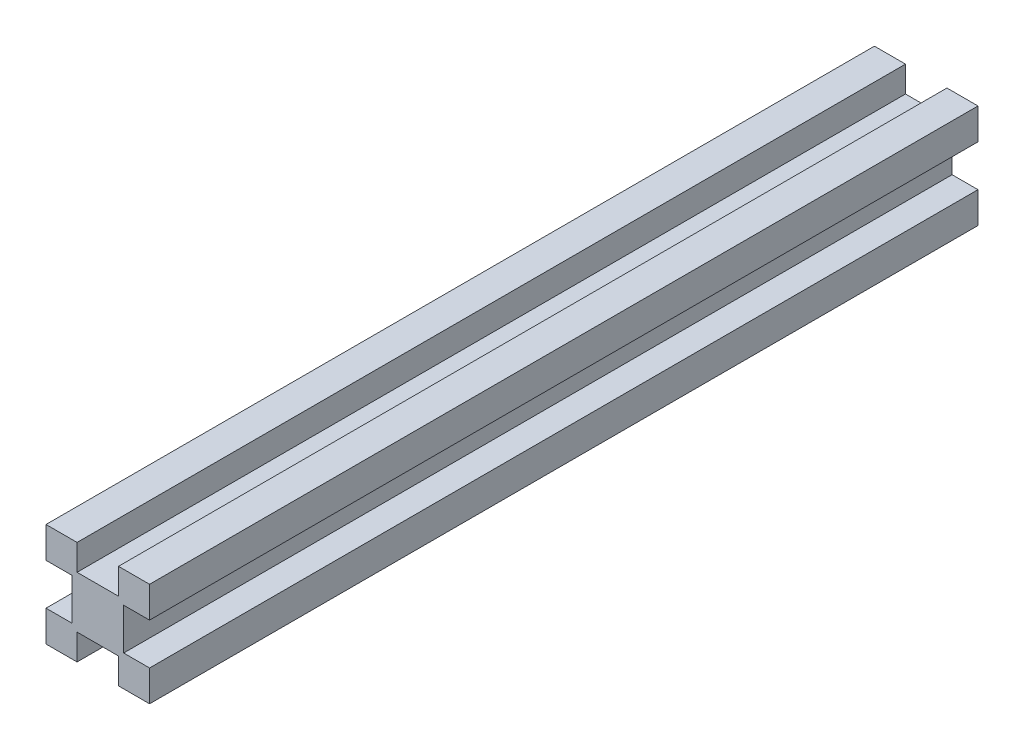
from build123d import *

# Parameters (mm, degrees)
CROQUIS1_W              = 20
CROQUIS1_H              = 20
SALIENTE_EXTRUIR1_DEPTH = 160
CORTAR_EXTRUIR1_DEPTH   = 320


with BuildPart() as part:
    # Croquis1 → Saliente-Extruir1 (new body)
    with BuildSketch(Plane.XY):
        with Locations((-13.532555049, 4.541666667)):
            Rectangle(CROQUIS1_W, CROQUIS1_H)
    extrude(amount=SALIENTE_EXTRUIR1_DEPTH)

    # Croquis2 → Cortar-Extruir1 (cut)
    with BuildSketch(Plane.XY.offset(160)):
        Polygon((-13.532555049, 9.541666667), (-17.532555049, 9.541666667), (-17.532555049, 14.541666667), (-9.532555049, 14.541666667), (-9.532555049, 9.541666667), align=None)
        Polygon((-9.532555049, -0.458333333), (-9.532555049, -5.458333333), (-17.532555049, -5.458333333), (-17.532555049, -0.458333333), (-13.532555049, -0.458333333), align=None)
        Polygon((-23.532555049, 4.541666667), (-23.532555049, 8.541666667), (-18.532555049, 8.541666667), (-18.532555049, 0.541666667), (-23.532555049, 0.541666667), align=None)
        Polygon((-8.532555049, 8.541666667), (-8.532555049, 0.541666667), (-3.532555049, 0.541666667), (-3.532555049, 4.541666667), (-3.532555049, 8.541666667), align=None)
    extrude(amount=-CORTAR_EXTRUIR1_DEPTH, mode=Mode.SUBTRACT)


solid = part.part
